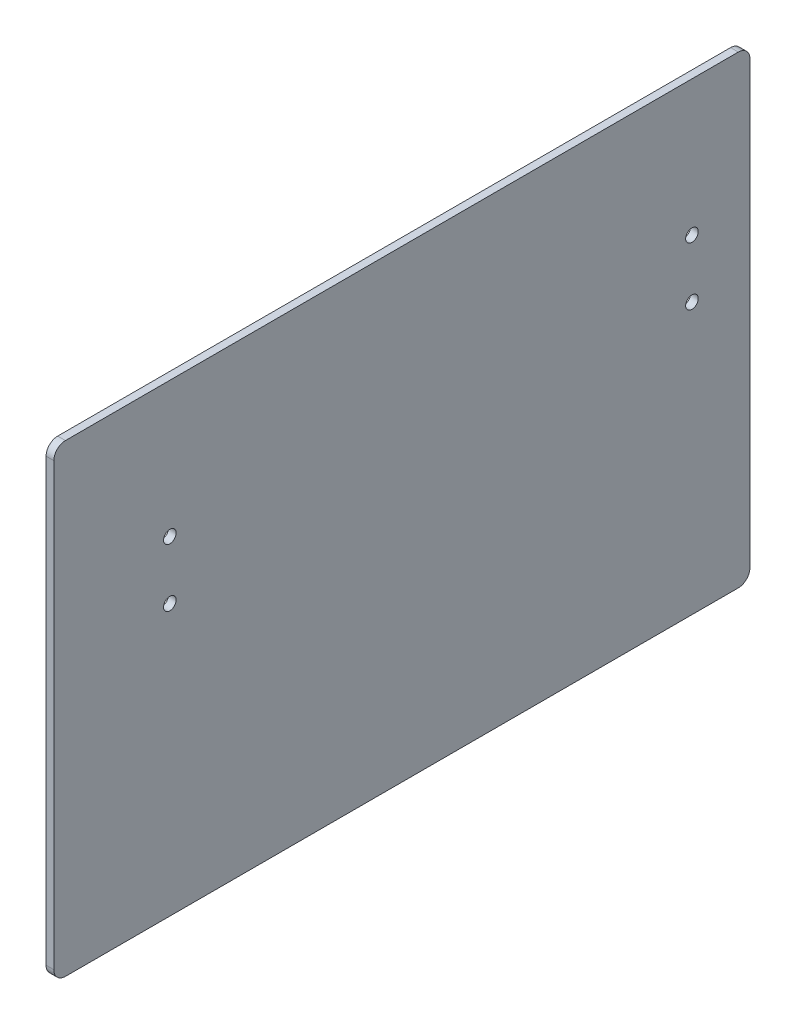
from build123d import *

# Parameters (mm, degrees)
SKETCH1_W                  = 360
SKETCH1_H                  = 240
BOSS_EXTRUDE1_DEPTH        = 2
FILLET3_R                  = 6
F_6_5_6_5_DIAMETER_HOLE1_D = 6.5


with BuildPart() as part:
    # Sketch1 → Boss-Extrude1 (new, symmetric)
    with BuildSketch(Plane(origin=(0, 0, 0), x_dir=(0, 0, -1), z_dir=(1, 0, 0))):
        with Locations((0, 17.25)):
            Rectangle(SKETCH1_W, SKETCH1_H)
    extrude(amount=BOSS_EXTRUDE1_DEPTH, both=True)

    # Fillet3
    fillet3_edges = [part.edges().sort_by_distance(p)[0] for p in [
        (0, -102.75, -180),
        (0, -102.75, 180),
        (0, 137.25, 180),
        (0, 137.25, -180),
    ]]
    fillet(fillet3_edges, radius=FILLET3_R)

    # Ø6.5 (6.5) Diameter Hole1 (through all)
    with Locations(Plane(origin=(2, 0, 0), x_dir=(0, 0, -1), z_dir=(1, 0, 0))):
        with Locations((-120, 67.25), (150, 37.25), (-120, 37.25), (150, 67.25)):
            Hole(F_6_5_6_5_DIAMETER_HOLE1_D / 2)


solid = part.part
